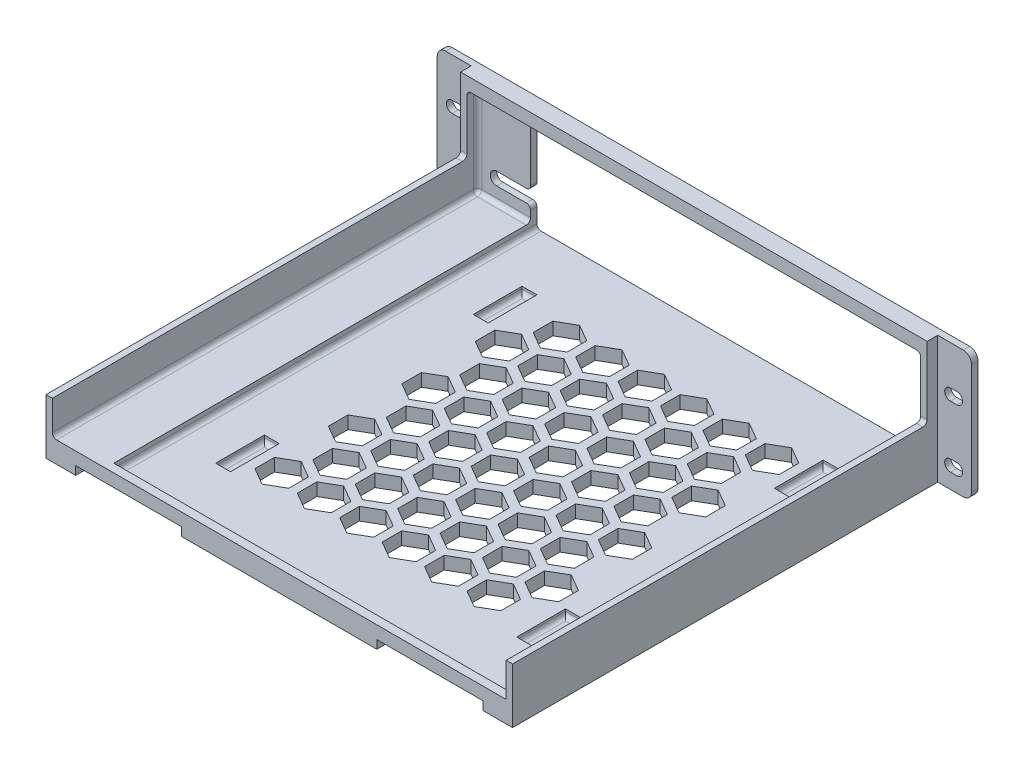
from build123d import *

# Parameters (mm, degrees)
SKETCH2_W           = 252
SKETCH2_H           = 60
BOSS_EXTRUDE1_DEPTH = 3
SKETCH3_W           = 220
SKETCH3_H           = 6
BOSS_EXTRUDE2_DEPTH = 200.5
SKETCH6_W           = 189
SKETCH6_H           = 48
CUT_EXTRUDE1_DEPTH  = 4
CUT_EXTRUDE11_DEPTH = 3
SKETCH10_W          = 3
SKETCH10_H          = 20
BOSS_EXTRUDE7_DEPTH = 200.5
BOSS_EXTRUDE8_DEPTH = 5
SKETCH11_W          = 7
SKETCH11_H          = 23
CUT_EXTRUDE12_DEPTH = 3
CUT_EXTRUDE13_DEPTH = 6
BOSS_EXTRUDE9_DEPTH = 4
SKETCH18_W          = 50
SKETCH18_H          = 4
CUT_EXTRUDE14_DEPTH = 4
FILLET1_R           = 4
FILLET2_R           = 2
FILLET3_R           = 2


with BuildPart() as part:
    # Sketch2 → Boss-Extrude1 (new body)
    with BuildSketch(Plane.XY):
        with Locations((126, 30)):
            Rectangle(SKETCH2_W, SKETCH2_H)
        with BuildLine():
            Line((245, 36.1), (242, 36.1))
            ThreePointArc((242, 36.1), (239.3, 38.8), (242, 41.5))
            Line((242, 41.5), (245, 41.5))
            ThreePointArc((245, 41.5), (247.7, 38.8), (245, 36.1))
        make_face(mode=Mode.SUBTRACT)
        with BuildLine():
            Line((242, 12.5), (245, 12.5))
            ThreePointArc((245, 12.5), (247.7, 9.8), (245, 7.1))
            Line((245, 7.1), (242, 7.1))
            ThreePointArc((242, 7.1), (239.3, 9.8), (242, 12.5))
        make_face(mode=Mode.SUBTRACT)
        with BuildLine():
            Line((7, 41.5), (10, 41.5))
            ThreePointArc((10, 41.5), (12.7, 38.8), (10, 36.1))
            Line((10, 36.1), (7, 36.1))
            ThreePointArc((7, 36.1), (4.3, 38.8), (7, 41.5))
        make_face(mode=Mode.SUBTRACT)
        with BuildLine():
            Line((7, 12.5), (10, 12.5))
            ThreePointArc((10, 12.5), (12.7, 9.8), (10, 7.1))
            Line((10, 7.1), (7, 7.1))
            ThreePointArc((7, 7.1), (4.3, 9.8), (7, 12.5))
        make_face(mode=Mode.SUBTRACT)
    extrude(amount=BOSS_EXTRUDE1_DEPTH)

    # Sketch3 → Boss-Extrude2 (add)
    with BuildSketch(Plane.XY.offset(3)):
        with Locations((126, 3)):
            Rectangle(SKETCH3_W, SKETCH3_H)
    extrude(amount=BOSS_EXTRUDE2_DEPTH)

    # Sketch6 → Cut-Extrude1 (cut)
    with BuildSketch(Plane(origin=(0, 0, 0), x_dir=(-1, 0, 0), z_dir=(0, 0, -1))):
        with Locations((-138.5, 30)):
            Rectangle(SKETCH6_W, SKETCH6_H)
    extrude(amount=-CUT_EXTRUDE1_DEPTH, mode=Mode.SUBTRACT)

    # Sketch9 → Cut-Extrude11 (cut)
    with BuildSketch(Plane(origin=(0, 0, 0), x_dir=(-1, 0, 0), z_dir=(0, 0, -1))):
        with BuildLine():
            Line((-28, 23), (-44, 23))
            Line((-44, 23), (-44, 17))
            Line((-44, 17), (-28, 17))
            ThreePointArc((-28, 17), (-25, 20), (-28, 23))
        make_face()
    extrude(amount=-CUT_EXTRUDE11_DEPTH, mode=Mode.SUBTRACT)

    # Sketch10 → Boss-Extrude7 (add)
    with BuildSketch(Plane.XY.offset(3)):
        with Locations((17.5, 16)):
            Rectangle(SKETCH10_W, SKETCH10_H)
        with Locations((234.5, 16)):
            Rectangle(SKETCH10_W, SKETCH10_H)
    extrude(amount=BOSS_EXTRUDE7_DEPTH)

    # Sketch15 → Boss-Extrude8 (add)
    with BuildSketch(Plane.XY.offset(3)):
        Polygon((236, 26), (236, 60), (16, 60), (16, 26), (19, 26), (19, 54), (233, 54), (233, 26), align=None)
    extrude(amount=BOSS_EXTRUDE8_DEPTH)

    # Sketch11 → Cut-Extrude12 (cut)
    with BuildSketch(Plane(origin=(0, 6, 0), x_dir=(1, 0, 0), z_dir=(0, 1, 0))):
        with Locations((209.5, -38.5)):
            Rectangle(SKETCH11_W, SKETCH11_H)
        with Locations((67.5, -38.5)):
            Rectangle(SKETCH11_W, SKETCH11_H)
        with Locations((209.5, -160)):
            Rectangle(SKETCH11_W, SKETCH11_H)
        with Locations((67.5, -160)):
            Rectangle(SKETCH11_W, SKETCH11_H)
    extrude(amount=-CUT_EXTRUDE12_DEPTH, mode=Mode.SUBTRACT)

    # Sketch13 → Cut-Extrude13 (cut)
    with BuildSketch(Plane(origin=(0, 6, 0), x_dir=(1, 0, 0), z_dir=(0, 1, 0))):
        Polygon((113.5, -47.865826042), (121.5, -43.247023889), (121.5, -34.009419582), (113.5, -29.390617428), (105.5, -34.009419582), (105.5, -43.247023889), align=None)
        Polygon((93.5, -47.865826042), (101.5, -43.247023889), (101.5, -34.009419582), (93.5, -29.390617428), (85.5, -34.009419582), (85.5, -43.247023889), align=None)
        Polygon((133.5, -47.865826042), (141.5, -43.247023889), (141.5, -34.009419582), (133.5, -29.390617428), (125.5, -34.009419582), (125.5, -43.247023889), align=None)
        Polygon((153.5, -47.865826042), (161.5, -43.247023889), (161.5, -34.009419582), (153.5, -29.390617428), (145.5, -34.009419582), (145.5, -43.247023889), align=None)
        Polygon((173.5, -47.865826042), (181.5, -43.247023889), (181.5, -34.009419582), (173.5, -29.390617428), (165.5, -34.009419582), (165.5, -43.247023889), align=None)
        Polygon((193.5, -47.865826042), (201.5, -43.247023889), (201.5, -34.009419582), (193.5, -29.390617428), (185.5, -34.009419582), (185.5, -43.247023889), align=None)
        Polygon((103.5, -65.186334118), (111.5, -60.567531964), (111.5, -51.329927657), (103.5, -46.711125504), (95.5, -51.329927657), (95.5, -60.567531964), align=None)
        Polygon((83.5, -65.186334118), (91.5, -60.567531964), (91.5, -51.329927657), (83.5, -46.711125504), (75.5, -51.329927657), (75.5, -60.567531964), align=None)
        Polygon((123.5, -65.186334118), (131.5, -60.567531964), (131.5, -51.329927657), (123.5, -46.711125504), (115.5, -51.329927657), (115.5, -60.567531964), align=None)
        Polygon((143.5, -65.186334118), (151.5, -60.567531964), (151.5, -51.329927657), (143.5, -46.711125504), (135.5, -51.329927657), (135.5, -60.567531964), align=None)
        Polygon((163.5, -65.186334118), (171.5, -60.567531964), (171.5, -51.329927657), (163.5, -46.711125504), (155.5, -51.329927657), (155.5, -60.567531964), align=None)
        Polygon((183.5, -65.186334118), (191.5, -60.567531964), (191.5, -51.329927657), (183.5, -46.711125504), (175.5, -51.329927657), (175.5, -60.567531964), align=None)
        Polygon((113.5, -82.506842193), (121.5, -77.88804004), (121.5, -68.650435733), (113.5, -64.031633579), (105.5, -68.650435733), (105.5, -77.88804004), align=None)
        Polygon((93.5, -82.506842193), (101.5, -77.88804004), (101.5, -68.650435733), (93.5, -64.031633579), (85.5, -68.650435733), (85.5, -77.88804004), align=None)
        Polygon((133.5, -82.506842193), (141.5, -77.88804004), (141.5, -68.650435733), (133.5, -64.031633579), (125.5, -68.650435733), (125.5, -77.88804004), align=None)
        Polygon((153.5, -82.506842193), (161.5, -77.88804004), (161.5, -68.650435733), (153.5, -64.031633579), (145.5, -68.650435733), (145.5, -77.88804004), align=None)
        Polygon((173.5, -82.506842193), (181.5, -77.88804004), (181.5, -68.650435733), (173.5, -64.031633579), (165.5, -68.650435733), (165.5, -77.88804004), align=None)
        Polygon((193.5, -82.506842193), (201.5, -77.88804004), (201.5, -68.650435733), (193.5, -64.031633579), (185.5, -68.650435733), (185.5, -77.88804004), align=None)
        Polygon((103.5, -99.827350269), (111.5, -95.208548116), (111.5, -85.970943809), (103.5, -81.352141655), (95.5, -85.970943809), (95.5, -95.208548116), align=None)
        Polygon((83.5, -99.827350269), (91.5, -95.208548116), (91.5, -85.970943809), (83.5, -81.352141655), (75.5, -85.970943809), (75.5, -95.208548116), align=None)
        Polygon((123.5, -99.827350269), (131.5, -95.208548116), (131.5, -85.970943809), (123.5, -81.352141655), (115.5, -85.970943809), (115.5, -95.208548116), align=None)
        Polygon((143.5, -99.827350269), (151.5, -95.208548116), (151.5, -85.970943809), (143.5, -81.352141655), (135.5, -85.970943809), (135.5, -95.208548116), align=None)
        Polygon((163.5, -99.827350269), (171.5, -95.208548116), (171.5, -85.970943809), (163.5, -81.352141655), (155.5, -85.970943809), (155.5, -95.208548116), align=None)
        Polygon((183.5, -99.827350269), (191.5, -95.208548116), (191.5, -85.970943809), (183.5, -81.352141655), (175.5, -85.970943809), (175.5, -95.208548116), align=None)
        Polygon((113.5, -117.147858345), (121.5, -112.529056191), (121.5, -103.291451884), (113.5, -98.672649731), (105.5, -103.291451884), (105.5, -112.529056191), align=None)
        Polygon((93.5, -117.147858345), (101.5, -112.529056191), (101.5, -103.291451884), (93.5, -98.672649731), (85.5, -103.291451884), (85.5, -112.529056191), align=None)
        Polygon((133.5, -117.147858345), (141.5, -112.529056191), (141.5, -103.291451884), (133.5, -98.672649731), (125.5, -103.291451884), (125.5, -112.529056191), align=None)
        Polygon((153.5, -117.147858345), (161.5, -112.529056191), (161.5, -103.291451884), (153.5, -98.672649731), (145.5, -103.291451884), (145.5, -112.529056191), align=None)
        Polygon((173.5, -117.147858345), (181.5, -112.529056191), (181.5, -103.291451884), (173.5, -98.672649731), (165.5, -103.291451884), (165.5, -112.529056191), align=None)
        Polygon((193.5, -117.147858345), (201.5, -112.529056191), (201.5, -103.291451884), (193.5, -98.672649731), (185.5, -103.291451884), (185.5, -112.529056191), align=None)
        Polygon((103.5, -134.468366421), (111.5, -129.849564267), (111.5, -120.61195996), (103.5, -115.993157806), (95.5, -120.61195996), (95.5, -129.849564267), align=None)
        Polygon((83.5, -134.468366421), (91.5, -129.849564267), (91.5, -120.61195996), (83.5, -115.993157806), (75.5, -120.61195996), (75.5, -129.849564267), align=None)
        Polygon((123.5, -134.468366421), (131.5, -129.849564267), (131.5, -120.61195996), (123.5, -115.993157806), (115.5, -120.61195996), (115.5, -129.849564267), align=None)
        Polygon((143.5, -134.468366421), (151.5, -129.849564267), (151.5, -120.61195996), (143.5, -115.993157806), (135.5, -120.61195996), (135.5, -129.849564267), align=None)
        Polygon((163.5, -134.468366421), (171.5, -129.849564267), (171.5, -120.61195996), (163.5, -115.993157806), (155.5, -120.61195996), (155.5, -129.849564267), align=None)
        Polygon((183.5, -134.468366421), (191.5, -129.849564267), (191.5, -120.61195996), (183.5, -115.993157806), (175.5, -120.61195996), (175.5, -129.849564267), align=None)
        Polygon((113.5, -151.788874496), (121.5, -147.170072343), (121.5, -137.932468036), (113.5, -133.313665882), (105.5, -137.932468036), (105.5, -147.170072343), align=None)
        Polygon((93.5, -151.788874496), (101.5, -147.170072343), (101.5, -137.932468036), (93.5, -133.313665882), (85.5, -137.932468036), (85.5, -147.170072343), align=None)
        Polygon((133.5, -151.788874496), (141.5, -147.170072343), (141.5, -137.932468036), (133.5, -133.313665882), (125.5, -137.932468036), (125.5, -147.170072343), align=None)
        Polygon((153.5, -151.788874496), (161.5, -147.170072343), (161.5, -137.932468036), (153.5, -133.313665882), (145.5, -137.932468036), (145.5, -147.170072343), align=None)
        Polygon((173.5, -151.788874496), (181.5, -147.170072343), (181.5, -137.932468036), (173.5, -133.313665882), (165.5, -137.932468036), (165.5, -147.170072343), align=None)
        Polygon((193.5, -151.788874496), (201.5, -147.170072343), (201.5, -137.932468036), (193.5, -133.313665882), (185.5, -137.932468036), (185.5, -147.170072343), align=None)
        Polygon((103.5, -169.109382572), (111.5, -164.490580418), (111.5, -155.252976111), (103.5, -150.634173958), (95.5, -155.252976111), (95.5, -164.490580418), align=None)
        Polygon((83.5, -169.109382572), (91.5, -164.490580418), (91.5, -155.252976111), (83.5, -150.634173958), (75.5, -155.252976111), (75.5, -164.490580418), align=None)
        Polygon((123.5, -169.109382572), (131.5, -164.490580418), (131.5, -155.252976111), (123.5, -150.634173958), (115.5, -155.252976111), (115.5, -164.490580418), align=None)
        Polygon((143.5, -169.109382572), (151.5, -164.490580418), (151.5, -155.252976111), (143.5, -150.634173958), (135.5, -155.252976111), (135.5, -164.490580418), align=None)
        Polygon((163.5, -169.109382572), (171.5, -164.490580418), (171.5, -155.252976111), (163.5, -150.634173958), (155.5, -155.252976111), (155.5, -164.490580418), align=None)
        Polygon((183.5, -169.109382572), (191.5, -164.490580418), (191.5, -155.252976111), (183.5, -150.634173958), (175.5, -155.252976111), (175.5, -164.490580418), align=None)
    extrude(amount=-CUT_EXTRUDE13_DEPTH, mode=Mode.SUBTRACT)

    # Sketch17 → Boss-Extrude9 (add)
    with BuildSketch(Plane(origin=(0, 6, 0), x_dir=(1, 0, 0), z_dir=(0, 1, 0))):
        Polygon((19, -203.5), (233, -203.5), (233, -199.5), (44, -199.5), (44, -3), (19, -3), align=None)
    extrude(amount=BOSS_EXTRUDE9_DEPTH)

    # Sketch18 → Cut-Extrude14 (cut)
    with BuildSketch(Plane.XY.offset(203.5)):
        with Locations((197, 2)):
            Rectangle(SKETCH18_W, SKETCH18_H)
        with Locations((55, 2)):
            Rectangle(SKETCH18_W, SKETCH18_H)
    extrude(amount=-CUT_EXTRUDE14_DEPTH, mode=Mode.SUBTRACT)

    # Fillet1
    fillet1_edges = [part.edges().sort_by_distance(p)[0] for p in [
        (0, 60, 1.5),
        (252, 60, 1.5),
        (252, 0, 1.5),
        (0, 0, 1.5),
    ]]
    fillet(fillet1_edges, radius=FILLET1_R)

    # Fillet2
    fillet2_edges = [part.edges().sort_by_distance(p)[0] for p in [
        (44, 17, 1.5),
        (44, 23, 1.5),
        (19, 32, 3),
        (233, 6, 99.75),
        (19, 10, 103.25),
        (31.5, 10, 3),
        (31.5, 54, 3),
        (19, 54, 5.5),
        (234.5, 26, 8),
        (17.5, 26, 8),
        (233, 54, 4),
        (44, 6, 99.75),
        (44, 54, 1.5),
    ]]
    fillet(fillet2_edges, radius=FILLET2_R)

    # Fillet3
    fillet3_edges = [part.edges().sort_by_distance(p)[0] for p in [
        (64, 3, 38.5),
        (67.5, 3, 27),
        (71, 3, 38.5),
        (67.5, 3, 50),
        (213, 3, 160),
        (209.5, 3, 171.5),
        (206, 3, 160),
        (209.5, 3, 148.5),
        (64, 3, 160),
        (67.5, 3, 148.5),
        (71, 3, 160),
        (67.5, 3, 171.5),
        (213, 3, 38.5),
        (209.5, 3, 50),
        (206, 3, 38.5),
        (209.5, 3, 27),
    ]]
    fillet(fillet3_edges, radius=FILLET3_R)


solid = part.part
